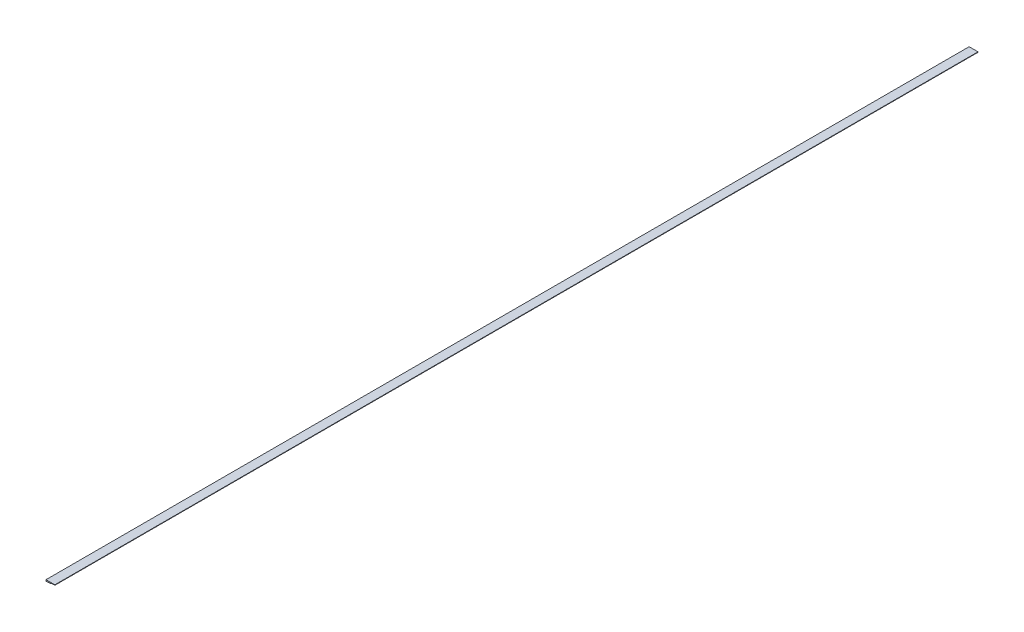
from build123d import *

# Parameters (mm, degrees)
BOSS_EXTRUDE1_DEPTH = 5214.4


with BuildPart() as part:
    # Sketch2 → Boss-Extrude1 (new body)
    with BuildSketch(Plane.XY):
        Polygon((-7.619424107, 25.4), (-32.619424107, 23.212783412), (-32.619424107, 31.086256538), (17.380575893, 31.086256538), (17.380575893, 28.575), (-4.444424107, 28.575), (-4.444424107, 25.4), align=None)
    extrude(amount=-BOSS_EXTRUDE1_DEPTH)


solid = part.part
